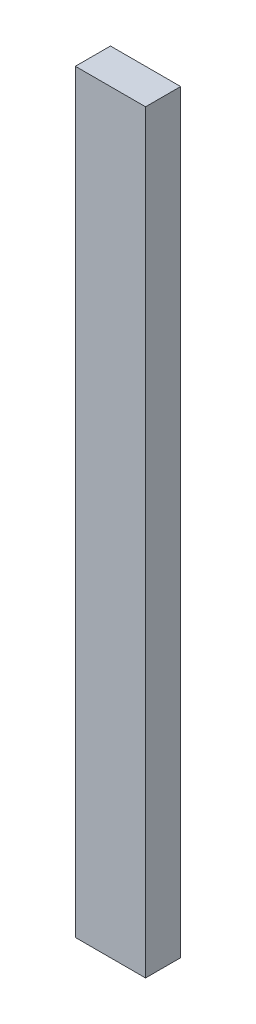
from build123d import *

# Parameters (mm, degrees)
SKETCH1_W           = 12.7
SKETCH1_H           = 136.525
BOSS_EXTRUDE1_DEPTH = 6.35


with BuildPart() as part:
    # Sketch1 → Boss-Extrude1 (new body)
    with BuildSketch(Plane.XY):
        with Locations((6.35, -76.2)):
            Rectangle(SKETCH1_W, SKETCH1_H)
    extrude(amount=BOSS_EXTRUDE1_DEPTH)


solid = part.part
